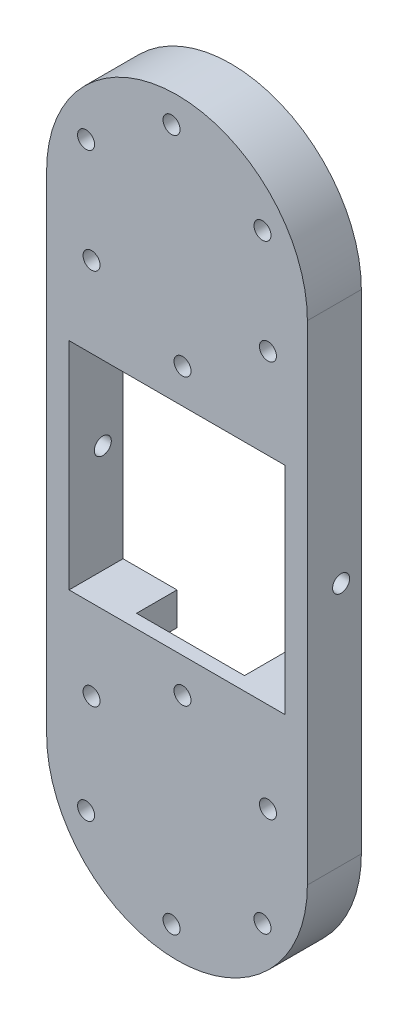
from build123d import *

# Parameters (mm, degrees)
SKETCH1_R           = 27.5
SKETCH1_W           = 50.8
SKETCH1_H           = 50.8
BOSS_EXTRUDE1_DEPTH = 12.7
BOSS_EXTRUDE2_START = -3.175
SKETCH2_R           = 2
SKETCH2_W           = 50.8
SKETCH2_H           = 50.8
BOSS_EXTRUDE2_DEPTH = 3.175
SKETCH7_R           = 2
CUT_EXTRUDE4_DEPTH  = 10
SKETCH8_W           = 25.4
SKETCH8_H           = 75
CUT_EXTRUDE5_DEPTH  = 9.525


with BuildPart() as part:
    # Sketch1 → Boss-Extrude1 (new body)
    with BuildSketch(Plane.XY):
        with BuildLine():
            Line((30.675000233, 57.5), (30.675000233, -57.5))
            ThreePointArc((30.675000233, -57.5), (0, -88.175000233), (-30.675000233, -57.5))
            Line((-30.675000233, -57.5), (-30.675000233, 57.5))
            ThreePointArc((-30.675000233, 57.5), (0, 88.175000233), (30.675000233, 57.5))
        make_face()
        with Locations((0, -57.5)):
            Circle(SKETCH1_R, mode=Mode.SUBTRACT)
        with Locations(Location((0, 57.5, 0), (0, 0, 180))):
            Circle(SKETCH1_R, mode=Mode.SUBTRACT)
        Rectangle(SKETCH1_W, SKETCH1_H, mode=Mode.SUBTRACT)
    extrude(amount=BOSS_EXTRUDE1_DEPTH)

    # Sketch2 → Boss-Extrude2 (add)
    with BuildSketch(Plane.XY.offset(12.7).offset(BOSS_EXTRUDE2_START)):
        with BuildLine():
            Line((30.675000233, -57.5), (30.675000233, 57.5))
            ThreePointArc((30.675000233, 57.5), (0, 88.175000233), (-30.675000233, 57.5))
            Line((-30.675000233, 57.5), (-30.675000233, -57.5))
            ThreePointArc((-30.675000233, -57.5), (0, -88.175000233), (30.675000233, -57.5))
        make_face()
        with Locations((-1.290716795, 81.465267579)):
            Circle(SKETCH2_R, mode=Mode.SUBTRACT)
        with Locations((20.109172135, 70.600427323)):
            Circle(SKETCH2_R, mode=Mode.SUBTRACT)
        with Locations((21.39988893, 46.635159744)):
            Circle(SKETCH2_R, mode=Mode.SUBTRACT)
        with Locations((1.290716795, 33.534732421)):
            Circle(SKETCH2_R, mode=Mode.SUBTRACT)
        with Locations((-20.109172135, 44.399572677)):
            Circle(SKETCH2_R, mode=Mode.SUBTRACT)
        with Locations((-21.39988893, 68.364840256)):
            Circle(SKETCH2_R, mode=Mode.SUBTRACT)
        with Locations(Location((-21.39988893, -68.364840256, 0), (0, 0, 180))):
            Circle(SKETCH2_R, mode=Mode.SUBTRACT)
        with Locations(Location((-20.109172135, -44.399572677, 0), (0, 0, 180))):
            Circle(SKETCH2_R, mode=Mode.SUBTRACT)
        with Locations(Location((1.290716795, -33.534732421, 0), (0, 0, 180))):
            Circle(SKETCH2_R, mode=Mode.SUBTRACT)
        with Locations(Location((21.39988893, -46.635159744, 0), (0, 0, 180))):
            Circle(SKETCH2_R, mode=Mode.SUBTRACT)
        with Locations(Location((20.109172135, -70.600427323, 0), (0, 0, 180))):
            Circle(SKETCH2_R, mode=Mode.SUBTRACT)
        with Locations(Location((-1.290716795, -81.465267579, 0), (0, 0, 180))):
            Circle(SKETCH2_R, mode=Mode.SUBTRACT)
        Rectangle(SKETCH2_W, SKETCH2_H, mode=Mode.SUBTRACT)
    extrude(amount=BOSS_EXTRUDE2_DEPTH)

    # Sketch7 → Cut-Extrude4 (cut)
    with BuildSketch(Plane.ZY.offset(30.675000233)):
        with Locations(Location((4.7625, 0, 0), (0, 0, 270))):
            Circle(SKETCH7_R)
    cut_extrude4 = extrude(amount=-CUT_EXTRUDE4_DEPTH, mode=Mode.SUBTRACT)

    # Mirror2: Cut-Extrude4 across plane
    add(cut_extrude4.mirror(Plane(origin=(0, 0, 0), x_dir=(0, 0, 1), z_dir=(1, 0, 0))), mode=Mode.SUBTRACT)

    # Sketch8 → Cut-Extrude5 (cut)
    with BuildSketch(Plane(origin=(0, 0, 0), x_dir=(-1, 0, 0), z_dir=(0, 0, -1))):
        Rectangle(SKETCH8_W, SKETCH8_H)
    extrude(amount=-CUT_EXTRUDE5_DEPTH, mode=Mode.SUBTRACT)


solid = part.part
